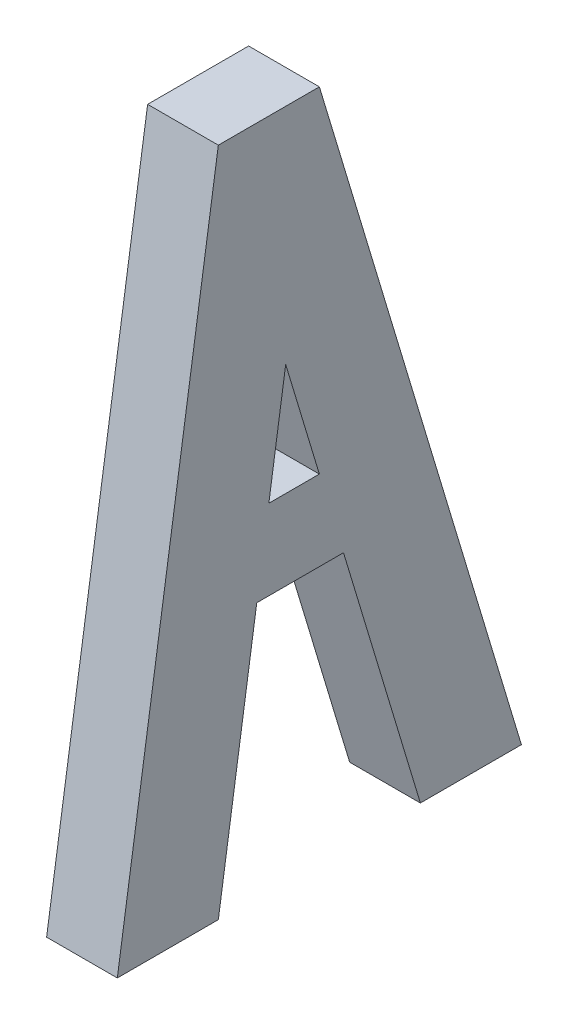
from build123d import *

# Parameters (mm, degrees)
SALIENTE_EXTRUIR1_DEPTH = 35


with BuildPart() as part:
    # Croquis3 → Saliente-Extruir1 (new body)
    with BuildSketch(Plane(origin=(0, 0, 0), x_dir=(0, 0, -1), z_dir=(1, 0, 0))):
        Polygon((-73.800980209, -80.62474503), (-123.800980209, -80.62474503), (-73.800980209, 251.36525497), (-23.800980209, 251.36525497), align=None)
        Polygon((-48.800980209, 85.37025497), (-54.775537144, 45.700391836), (-11.85186634, 45.700391836), (-23.800980209, 85.37025497), align=None)
        Polygon((-23.800980209, 85.37025497), (-11.85186634, 45.700391836), (26.199019791, -80.62474503), (76.199019791, -80.62474503), (-23.800980209, 251.36525497), (-40.467646876, 140.701921636), align=None)
    extrude(amount=SALIENTE_EXTRUIR1_DEPTH)


solid = part.part
